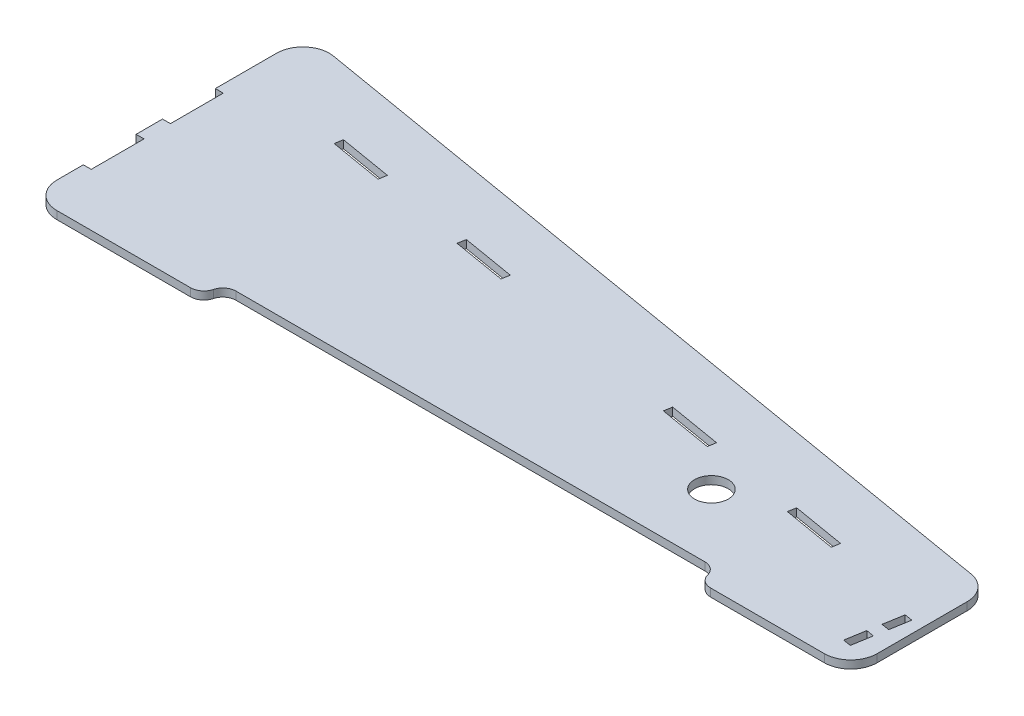
from build123d import *

# Parameters (mm, degrees)
BOSS_EXTRUDE1_DEPTH = 6
CUT_EXTRUDE1_DEPTH  = 6
SKETCH6_W           = 375
SKETCH6_H           = 15
CUT_EXTRUDE2_DEPTH  = 6
FILLET1_R           = 10
FILLET2_R           = 10
FILLET4_R           = 20
FILLET5_R           = 10
SKETCH7_R           = 12.75
CUT_EXTRUDE3_DEPTH  = 10
SKETCH9_W           = 6
SKETCH9_H           = 40
CUT_EXTRUDE4_DEPTH  = 10


with BuildPart() as part:
    # Sketch3 → Boss-Extrude1 (new body)
    with BuildSketch(Plane(origin=(0, 0, 0), x_dir=(1, 0, 0), z_dir=(0, 1, 0))):
        Polygon((-257.298523245, 138.590313781), (-257.298523245, -71.409686219), (363.88985398, -71.409686219), (363.88985398, 33.590313781), align=None)
    extrude(amount=BOSS_EXTRUDE1_DEPTH)

    # Sketch4 → Cut-Extrude1 (cut)
    with BuildSketch(Plane(origin=(0, 6, 0), x_dir=(1, 0, 0), z_dir=(0, 1, 0))):
        Polygon((-135.235417729, 76.815026044), (-175.235417729, 83.576260082), (-176.251293143, 77.566260082), (-136.251293143, 70.805026044), align=None)
        Polygon((-63.256447035, 64.648359377), (-64.272322449, 58.638359377), (-24.272322449, 51.877125339), (-23.256447035, 57.887125339), align=None)
        Polygon((124.743552965, 32.870559399), (164.743552965, 26.109325362), (163.727677551, 20.099325362), (123.727677551, 26.860559399), align=None)
        Polygon((237.743552965, 13.770073242), (277.743552965, 7.008839205), (276.727677551, 0.998839205), (236.727677551, 7.760073242), align=None)
        Polygon((349.053244456, -15.330412914), (346.517781692, -30.330412914), (352.517781692, -31.34459802), (355.053244456, -16.34459802), align=None)
        Polygon((344.851115025, -40.190545886), (342.315652261, -55.190545886), (348.315652261, -56.204730992), (350.851115025, -41.204730992), align=None)
    extrude(amount=-CUT_EXTRUDE1_DEPTH, mode=Mode.SUBTRACT)

    # Sketch6 → Cut-Extrude2 (cut)
    with BuildSketch(Plane(origin=(0, 6, 0), x_dir=(1, 0, 0), z_dir=(0, 1, 0))):
        with Locations((60.89290198, -63.909686219)):
            Rectangle(SKETCH6_W, SKETCH6_H)
    extrude(amount=-CUT_EXTRUDE2_DEPTH, mode=Mode.SUBTRACT)

    # Fillet1
    fillet1_edges = [part.edges().sort_by_distance(p)[0] for p in [
        (-126.60709802, 3, 56.409686219),
    ]]
    fillet(fillet1_edges, radius=FILLET1_R)

    # Fillet2
    fillet2_edges = [part.edges().sort_by_distance(p)[0] for p in [
        (248.39290198, 3, 56.409686219),
    ]]
    fillet(fillet2_edges, radius=FILLET2_R)

    # Fillet4
    fillet4_edges = [part.edges().sort_by_distance(p)[0] for p in [
        (363.88985398, 3, -33.590313781),
        (363.88985398, 3, 71.409686219),
        (-257.298523245, 3, 71.409686219),
        (-257.298523245, 3, -138.590313781),
    ]]
    fillet(fillet4_edges, radius=FILLET4_R)

    # Fillet5
    fillet5_edges = [part.edges().sort_by_distance(p)[0] for p in [
        (248.39290198, 3, 71.409686219),
        (-126.60709802, 3, 71.409686219),
    ]]
    fillet(fillet5_edges, radius=FILLET5_R)

    # Sketch7 → Cut-Extrude3 (cut)
    with BuildSketch(Plane(origin=(0, 6, 0), x_dir=(1, 0, 0), z_dir=(0, 1, 0))):
        with Locations(Location((193.372247473, -6.409686219, 0), (0, 0, 270))):
            Circle(SKETCH7_R)
    extrude(amount=-CUT_EXTRUDE3_DEPTH, mode=Mode.SUBTRACT)

    # Sketch9 → Cut-Extrude4 (cut)
    with BuildSketch(Plane(origin=(0, 6, 0), x_dir=(1, 0, 0), z_dir=(0, 1, 0))):
        with Locations((-254.298523245, 48.590313781)):
            Rectangle(SKETCH9_W, SKETCH9_H)
        with Locations((-254.298523245, -11.409686219)):
            Rectangle(SKETCH9_W, SKETCH9_H)
    extrude(amount=-CUT_EXTRUDE4_DEPTH, mode=Mode.SUBTRACT)


solid = part.part
